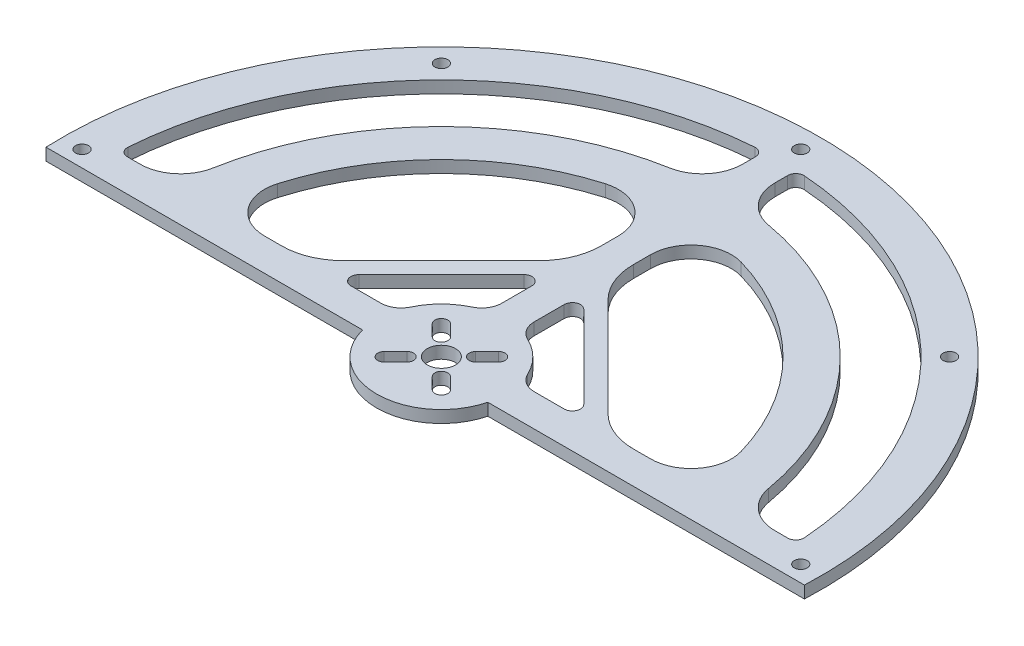
from build123d import *

# Parameters (mm, degrees)
SKETCH_1_R      = 1.6
SKETCH_1_R_2    = 3.5
EXTRUDE_1_DEPTH = 3


with BuildPart() as part:
    # 草图1 → 凸台-拉伸1 (new body)
    with BuildSketch(Plane(origin=(0, 0, 0), x_dir=(1, 0, 0), z_dir=(0, 1, 0))):
        with BuildLine():
            Line((46.95, -4), (83.804594146, -4))
            Line((83.804594146, -4), (93.814764296, -4))
            ThreePointArc((93.814764296, -4), (0, 93.9), (-93.814764296, -4))
            Line((-93.814764296, -4), (-83.804594146, -4))
            Line((-83.804594146, -4), (-46.95, -4))
            Line((-46.95, -4), (-15.491933385, -4))
            ThreePointArc((-15.491933385, -4), (0, -16), (15.491933385, -4))
            Line((15.491933385, -4), (46.95, -4))
        make_face()
        with Locations(Location((88.9, 0, 0), (0, 0, 270))):
            Circle(SKETCH_1_R, mode=Mode.SUBTRACT)
        with Locations(Location((-88.9, 0, 0), (0, 0, 270))):
            Circle(SKETCH_1_R, mode=Mode.SUBTRACT)
        with Locations(Location((-62.861792847, 62.861792847, 0), (0, 0, 270))):
            Circle(SKETCH_1_R, mode=Mode.SUBTRACT)
        with Locations(Location((0, 88.9, 0), (0, 0, 270))):
            Circle(SKETCH_1_R, mode=Mode.SUBTRACT)
        with Locations(Location((62.861792847, 62.861792847, 0), (0, 0, 270))):
            Circle(SKETCH_1_R, mode=Mode.SUBTRACT)
        with Locations(Location((0, 0, 0), (0, 0, 270))):
            Circle(SKETCH_1_R_2, mode=Mode.SUBTRACT)
        with BuildLine():
            Line((46.95, 4), (47.760369555, 4))
            ThreePointArc((47.760369555, 4), (55.764412134, 8.005393892), (57.356586062, 16.812939522))
            ThreePointArc((57.356586062, 16.812939522), (42.263772312, 42.263772312), (16.812939522, 57.356586062))
            ThreePointArc((16.812939522, 57.356586062), (8.005393892, 55.764412134), (4, 47.760369555))
            Line((4, 47.760369555), (4, 46.95))
            Line((4, 46.95), (4, 43.500766957))
            ThreePointArc((4, 43.500766957), (5.154045583, 37.698988024), (8.440489352, 32.780477341))
            Line((8.440489352, 32.780477341), (32.780477341, 8.440489352))
            ThreePointArc((32.780477341, 8.440489352), (37.698988024, 5.154045583), (43.500766957, 4))
            Line((43.500766957, 4), (46.95, 4))
        make_face(mode=Mode.SUBTRACT)
        with BuildLine():
            Line((-46.95, 4), (-43.500766957, 4))
            ThreePointArc((-43.500766957, 4), (-37.698988024, 5.154045583), (-32.780477341, 8.440489352))
            Line((-32.780477341, 8.440489352), (-8.440489352, 32.780477341))
            ThreePointArc((-8.440489352, 32.780477341), (-5.154045583, 37.698988024), (-4, 43.500766957))
            Line((-4, 43.500766957), (-4, 46.95))
            Line((-4, 46.95), (-4, 47.760369555))
            ThreePointArc((-4, 47.760369555), (-8.005393892, 55.764412134), (-16.812939522, 57.356586062))
            ThreePointArc((-16.812939522, 57.356586062), (-42.263772312, 42.263772312), (-57.356586062, 16.812939522))
            ThreePointArc((-57.356586062, 16.812939522), (-55.764412134, 8.005393892), (-47.760369555, 4))
            Line((-47.760369555, 4), (-46.95, 4))
        make_face(mode=Mode.SUBTRACT)
        with BuildLine():
            Line((-78.53185914, 4), (-81.679924094, 4))
            ThreePointArc((-81.679924094, 4), (-83.145024823, 4.638574331), (-83.674549835, 6.146520147))
            ThreePointArc((-83.674549835, 6.146520147), (-59.326258942, 59.326258942), (-6.146520147, 83.674549835))
            ThreePointArc((-6.146520147, 83.674549835), (-4.638574331, 83.145024823), (-4, 81.679924094))
            Line((-4, 81.679924094), (-4, 78.53185914))
            ThreePointArc((-4, 78.53185914), (-6.333499574, 72.111207209), (-12.244954243, 68.687072987))
            ThreePointArc((-12.244954243, 68.687072987), (-49.334840123, 49.334840123), (-68.687072987, 12.244954243))
            ThreePointArc((-68.687072987, 12.244954243), (-72.111207209, 6.333499574), (-78.53185914, 4))
        make_face(mode=Mode.SUBTRACT)
        with BuildLine():
            Line((4, 78.53185914), (4, 81.679924094))
            ThreePointArc((4, 81.679924094), (4.638574331, 83.145024823), (6.146520147, 83.674549835))
            ThreePointArc((6.146520147, 83.674549835), (59.326258942, 59.326258942), (83.674549835, 6.146520147))
            ThreePointArc((83.674549835, 6.146520147), (83.145024823, 4.638574331), (81.679924094, 4))
            Line((81.679924094, 4), (78.53185914, 4))
            ThreePointArc((78.53185914, 4), (72.111207209, 6.333499574), (68.687072987, 12.244954243))
            ThreePointArc((68.687072987, 12.244954243), (49.334840123, 49.334840123), (12.244954243, 68.687072987))
            ThreePointArc((12.244954243, 68.687072987), (6.333499574, 72.111207209), (4, 78.53185914))
        make_face(mode=Mode.SUBTRACT)
        with BuildLine():
            Line((-27.80675313, 7.414213562), (-7.414213562, 27.80675313))
            ThreePointArc((-7.414213562, 27.80675313), (-5.234633135, 28.240298633), (-4, 26.392539568))
            Line((-4, 26.392539568), (-4, 18.973665961))
            ThreePointArc((-4, 18.973665961), (-4.774228726, 16.301053542), (-6.857142857, 14.456126446))
            ThreePointArc((-6.857142857, 14.456126446), (-11.313708499, 11.313708499), (-14.456126446, 6.857142857))
            ThreePointArc((-14.456126446, 6.857142857), (-16.301053542, 4.774228726), (-18.973665961, 4))
            Line((-18.973665961, 4), (-26.392539568, 4))
            ThreePointArc((-26.392539568, 4), (-28.240298633, 5.234633135), (-27.80675313, 7.414213562))
        make_face(mode=Mode.SUBTRACT)
        with BuildLine():
            Line((27.80675313, 7.414213562), (7.414213562, 27.80675313))
            ThreePointArc((7.414213562, 27.80675313), (5.234633135, 28.240298633), (4, 26.392539568))
            Line((4, 26.392539568), (4, 18.973665961))
            ThreePointArc((4, 18.973665961), (4.774228726, 16.301053542), (6.857142857, 14.456126446))
            ThreePointArc((6.857142857, 14.456126446), (11.313708499, 11.313708499), (14.456126446, 6.857142857))
            ThreePointArc((14.456126446, 6.857142857), (16.301053542, 4.774228726), (18.973665961, 4))
            Line((18.973665961, 4), (26.392539568, 4))
            ThreePointArc((26.392539568, 4), (28.240298633, 5.234633135), (27.80675313, 7.414213562))
        make_face(mode=Mode.SUBTRACT)
        with BuildLine():
            Line((5.939696962, -8.202438662), (3.111269837, -5.374011537))
            ThreePointArc((3.111269837, -5.374011537), (3.111269837, -3.111269837), (5.374011537, -3.111269837))
            Line((5.374011537, -3.111269837), (8.202438662, -5.939696962))
            ThreePointArc((8.202438662, -5.939696962), (8.202438662, -8.202438662), (5.939696962, -8.202438662))
        make_face(mode=Mode.SUBTRACT)
        with BuildLine():
            Line((-8.202438662, -5.939696962), (-5.374011537, -3.111269837))
            ThreePointArc((-5.374011537, -3.111269837), (-3.111269837, -3.111269837), (-3.111269837, -5.374011537))
            Line((-3.111269837, -5.374011537), (-5.939696962, -8.202438662))
            ThreePointArc((-5.939696962, -8.202438662), (-8.202438662, -8.202438662), (-8.202438662, -5.939696962))
        make_face(mode=Mode.SUBTRACT)
        with BuildLine():
            Line((-5.939696962, 8.202438662), (-3.111269837, 5.374011537))
            ThreePointArc((-3.111269837, 5.374011537), (-3.111269837, 3.111269837), (-5.374011537, 3.111269837))
            Line((-5.374011537, 3.111269837), (-8.202438662, 5.939696962))
            ThreePointArc((-8.202438662, 5.939696962), (-8.202438662, 8.202438662), (-5.939696962, 8.202438662))
        make_face(mode=Mode.SUBTRACT)
        with BuildLine():
            Line((8.202438662, 5.939696962), (5.374011537, 3.111269837))
            ThreePointArc((5.374011537, 3.111269837), (3.111269837, 3.111269837), (3.111269837, 5.374011537))
            Line((3.111269837, 5.374011537), (5.939696962, 8.202438662))
            ThreePointArc((5.939696962, 8.202438662), (8.202438662, 8.202438662), (8.202438662, 5.939696962))
        make_face(mode=Mode.SUBTRACT)
    extrude(amount=EXTRUDE_1_DEPTH)


solid = part.part
